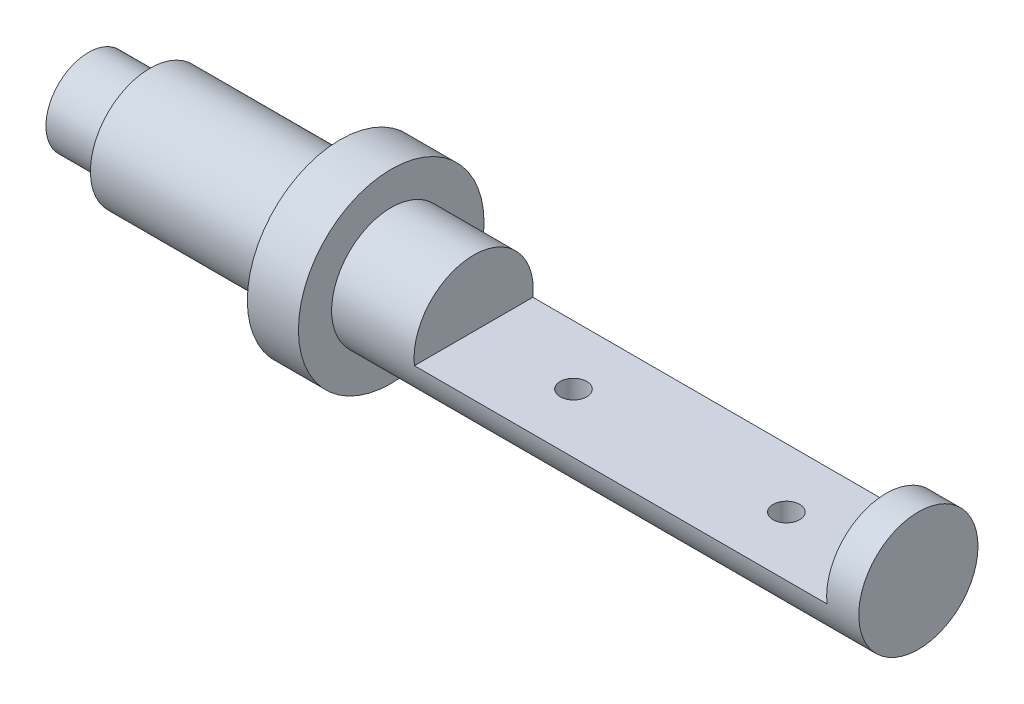
from build123d import *

# Parameters (mm, degrees)
CUT_EXTRUDE1_DEPTH      = 395.646626743
CUT_EXTRUDE1_DEPTH_BACK = 395.646626743
SKETCH2_W               = 193.8
SKETCH2_H               = 31.1
HOLE1_D                 = 12.5


with BuildPart() as part:
    # Sketch1 → Revolve1 (revolve)
    with BuildSketch(Plane.XY, mode=Mode.PRIVATE) as revolve1_sk:
        Polygon((0, 0), (0, 20), (28.9, 20), (28.9, 28), (118.2, 28), (118.2, 43.6), (142.2, 43.6), (142.2, 28), (389.8, 28), (389.8, 0), align=None)
    revolve(revolve1_sk.sketch.rotate(Axis((389.8, 0, 0), (-1, 0, 0)), 90), axis=Axis((389.8, 0, 0), (-1, 0, 0)))

    # Sketch2 → Cut-Extrude1 (cut, two sides: drawn at the far end of the back side and taken through both)
    with BuildSketch(Plane.XY.offset(-CUT_EXTRUDE1_DEPTH_BACK)):
        with Locations((277.8, 12.45)):
            Rectangle(SKETCH2_W, SKETCH2_H)
    extrude(amount=CUT_EXTRUDE1_DEPTH + CUT_EXTRUDE1_DEPTH_BACK, mode=Mode.SUBTRACT)

    # Hole1 (through all)
    with Locations(Plane(origin=(0, -3.1, 0), x_dir=(1, 0, 0), z_dir=(0, 1, 0))):
        with Locations((227.8, 0), (327.8, 0)):
            Hole(HOLE1_D / 2)


solid = part.part
